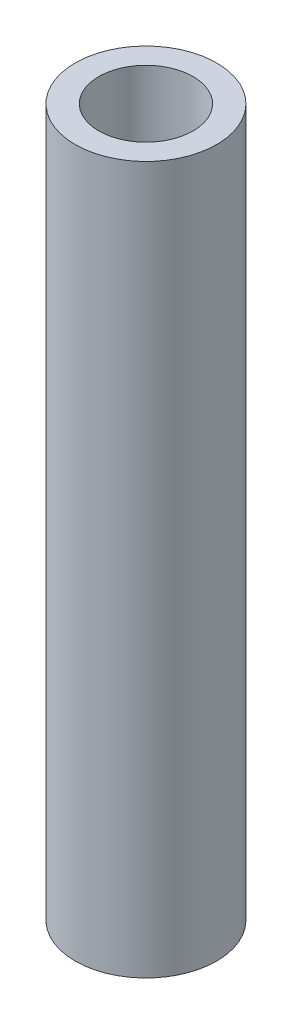
from build123d import *

# Parameters (mm, degrees)
SKETCH1_R           = 3
BOSS_EXTRUDE1_DEPTH = 30
SKETCH2_R           = 2
CUT_EXTRUDE1_DEPTH  = 31.298514815


with BuildPart() as part:
    # Sketch1 → Boss-Extrude1 (new body)
    with BuildSketch(Plane(origin=(0, 0, 0), x_dir=(1, 0, 0), z_dir=(0, 1, 0))):
        with Locations(Location((0, 0, 0), (0, 0, 270))):
            Circle(SKETCH1_R)
    extrude(amount=BOSS_EXTRUDE1_DEPTH)

    # Sketch2 → Cut-Extrude1 (cut, through all)
    with BuildSketch(Plane(origin=(0, 30, 0), x_dir=(1, 0, 0), z_dir=(0, 1, 0))):
        with Locations(Location((0, 0, 0), (0, 0, 270))):
            Circle(SKETCH2_R)
    extrude(amount=-CUT_EXTRUDE1_DEPTH, mode=Mode.SUBTRACT)


solid = part.part
